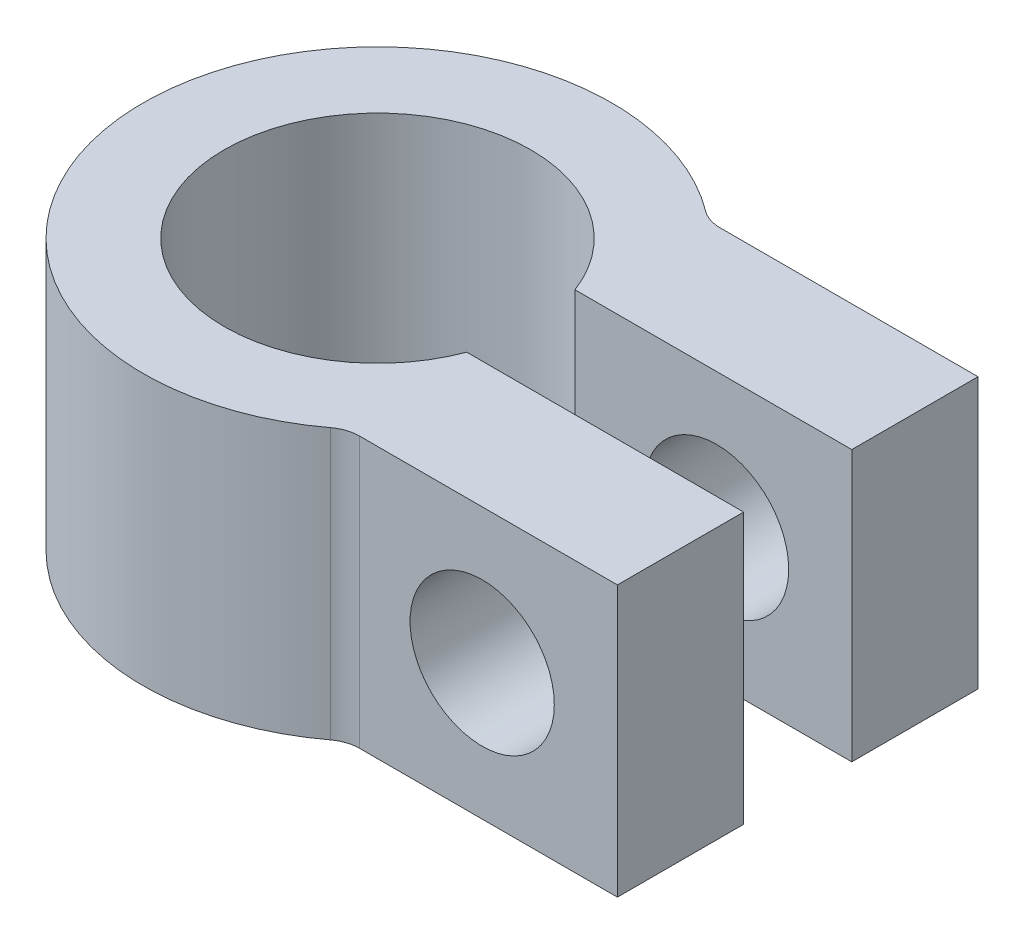
from build123d import *

# Parameters (mm, degrees)
SCHIZZO3_R           = 13
SCHIZZO3_R_2         = 8.5
ANELLO_DEPTH         = 15
AGGANCIOALTO_DEPTH   = 15
SCHIZZO5_W           = 23.306623863
SCHIZZO5_H           = 6
APERTURAANELLO_DEPTH = 31.61370144
SCHIZZO6_R           = 4
FOROPASSANTE_DEPTH   = 37.016644984
RACCORDOBASSO_R      = 2
RACCORDOALTO_R       = 2


with BuildPart() as part:
    # Schizzo3 → Anello (new body)
    with BuildSketch(Plane(origin=(0, 0, 0), x_dir=(1, 0, 0), z_dir=(0, 1, 0))):
        with Locations(Location((0, 0, 0), (0, 0, 270))):
            Circle(SCHIZZO3_R)
        with Locations(Location((0, 0, 0), (0, 0, 270))):
            Circle(SCHIZZO3_R_2, mode=Mode.SUBTRACT)
    extrude(amount=ANELLO_DEPTH)

    # Schizzo4 → AggancioAlto (add)
    with BuildSketch(Plane(origin=(0, 0, 0), x_dir=(1, 0, 0), z_dir=(0, 1, 0))):
        with BuildLine():
            Line((23.306623863, 3), (12.649110641, 3))
            ThreePointArc((12.649110641, 3), (11.046977059, 6.853050259), (8.306623863, 10))
            Line((8.306623863, 10), (23.306623863, 10))
            Line((23.306623863, 10), (23.306623863, 3))
        make_face()
    aggancioalto = extrude(amount=AGGANCIOALTO_DEPTH)

    # AggancioBasso: AggancioAlto across plane
    add(aggancioalto.mirror(Plane.XY))

    # Schizzo5 → AperturaAnello (cut, through all)
    with BuildSketch(Plane(origin=(0, 15, 0), x_dir=(1, 0, 0), z_dir=(0, 1, 0))):
        with Locations((11.653311932, 0)):
            Rectangle(SCHIZZO5_W, SCHIZZO5_H)
    extrude(amount=-APERTURAANELLO_DEPTH, mode=Mode.SUBTRACT)

    # Schizzo6 → ForoPassante (cut, through all)
    with BuildSketch(Plane.XY.offset(10)):
        with Locations((15.806623863, 7.5)):
            Circle(SCHIZZO6_R)
    extrude(amount=-FOROPASSANTE_DEPTH, mode=Mode.SUBTRACT)

    # RaccordoBasso
    raccordobasso_edges = [part.edges().sort_by_distance(p)[0] for p in [
        (8.306623863, 7.5, 10),
    ]]
    fillet(raccordobasso_edges, radius=RACCORDOBASSO_R)

    # RaccordoAlto
    raccordoalto_edges = [part.edges().sort_by_distance(p)[0] for p in [
        (8.306623863, 7.5, -10),
    ]]
    fillet(raccordoalto_edges, radius=RACCORDOALTO_R)


solid = part.part
